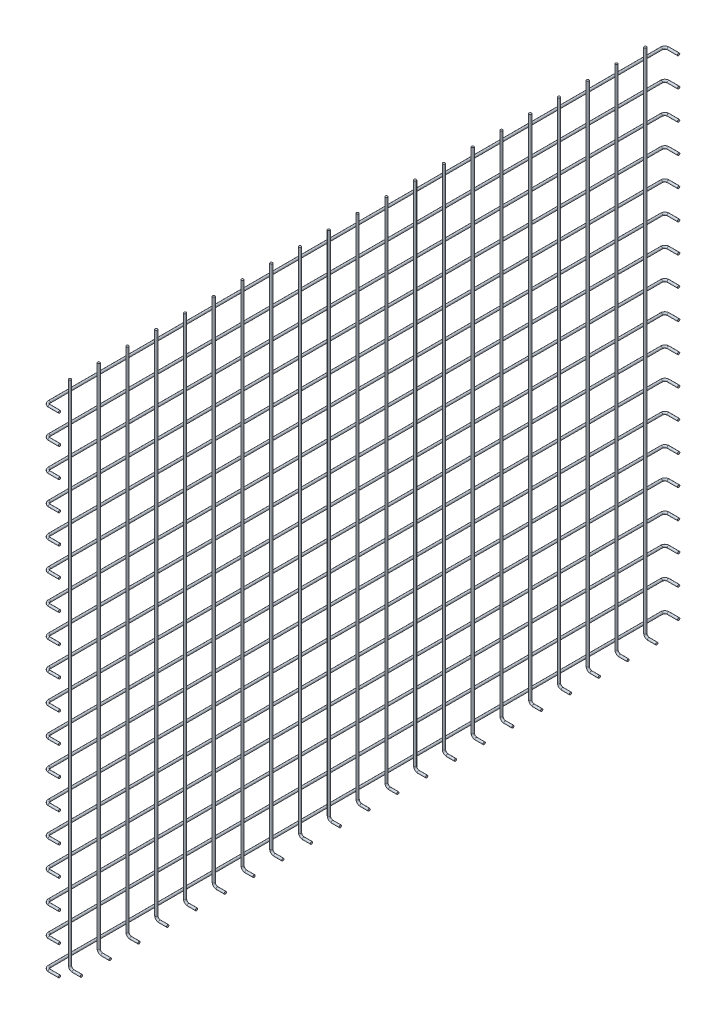
from build123d import *

# Parameters (mm, degrees)
SKETCH_2_R             = 2
PATTERN_LINEAR_2_COUNT = 11
PATTERN_LINEAR_2_PITCH = 50
PATTERN_LINEAR_3_COUNT = 11
PATTERN_LINEAR_3_PITCH = 50
SKETCH_4_R             = 2
PATTERN_LINEAR_4_COUNT = 18
PATTERN_LINEAR_4_PITCH = 50


with BuildPart() as part:
    # По траектории1: sweep along a path in Эскиз1
    with BuildLine(Plane.XY) as sweep_1_path:
        Line((20, 2), (6, 2))
        ThreePointArc((6, 2), (1.757359313, 3.757359313), (0, 8))
        Line((0, 8), (0, 890))
    # Эскиз2 → По траектории1 (sweep)
    with BuildSketch(Plane(origin=(20, 0, 0), x_dir=(0, 0, -1), z_dir=(1, 0, 0))):
        with Locations((0, 2)):
            Circle(SKETCH_2_R)
    sweep(path=sweep_1_path.line)


with BuildPart() as pattern_linear_2_1:
    # Линейный массив2: pattern copy
    add(part.part.moved(Location(Vector(0, 0, -1) * (1 * PATTERN_LINEAR_2_PITCH))))


with BuildPart() as pattern_linear_2_2:
    # Линейный массив2: pattern copy
    add(part.part.moved(Location(Vector(0, 0, -1) * (2 * PATTERN_LINEAR_2_PITCH))))


with BuildPart() as pattern_linear_2_3:
    # Линейный массив2: pattern copy
    add(part.part.moved(Location(Vector(0, 0, -1) * (3 * PATTERN_LINEAR_2_PITCH))))


with BuildPart() as pattern_linear_2_4:
    # Линейный массив2: pattern copy
    add(part.part.moved(Location(Vector(0, 0, -1) * (4 * PATTERN_LINEAR_2_PITCH))))


with BuildPart() as pattern_linear_2_5:
    # Линейный массив2: pattern copy
    add(part.part.moved(Location(Vector(0, 0, -1) * (5 * PATTERN_LINEAR_2_PITCH))))


with BuildPart() as pattern_linear_2_6:
    # Линейный массив2: pattern copy
    add(part.part.moved(Location(Vector(0, 0, -1) * (6 * PATTERN_LINEAR_2_PITCH))))


with BuildPart() as pattern_linear_2_7:
    # Линейный массив2: pattern copy
    add(part.part.moved(Location(Vector(0, 0, -1) * (7 * PATTERN_LINEAR_2_PITCH))))


with BuildPart() as pattern_linear_2_8:
    # Линейный массив2: pattern copy
    add(part.part.moved(Location(Vector(0, 0, -1) * (8 * PATTERN_LINEAR_2_PITCH))))


with BuildPart() as pattern_linear_2_9:
    # Линейный массив2: pattern copy
    add(part.part.moved(Location(Vector(0, 0, -1) * (9 * PATTERN_LINEAR_2_PITCH))))


with BuildPart() as pattern_linear_2_10:
    # Линейный массив2: pattern copy
    add(part.part.moved(Location(Vector(0, 0, -1) * (10 * PATTERN_LINEAR_2_PITCH))))


with BuildPart() as pattern_linear_3_1:
    # Линейный массив3: pattern copy
    add(part.part.moved(Location(Vector(0, 0, 1) * (1 * PATTERN_LINEAR_3_PITCH))))


with BuildPart() as pattern_linear_3_2:
    # Линейный массив3: pattern copy
    add(part.part.moved(Location(Vector(0, 0, 1) * (2 * PATTERN_LINEAR_3_PITCH))))


with BuildPart() as pattern_linear_3_3:
    # Линейный массив3: pattern copy
    add(part.part.moved(Location(Vector(0, 0, 1) * (3 * PATTERN_LINEAR_3_PITCH))))


with BuildPart() as pattern_linear_3_4:
    # Линейный массив3: pattern copy
    add(part.part.moved(Location(Vector(0, 0, 1) * (4 * PATTERN_LINEAR_3_PITCH))))


with BuildPart() as pattern_linear_3_5:
    # Линейный массив3: pattern copy
    add(part.part.moved(Location(Vector(0, 0, 1) * (5 * PATTERN_LINEAR_3_PITCH))))


with BuildPart() as pattern_linear_3_6:
    # Линейный массив3: pattern copy
    add(part.part.moved(Location(Vector(0, 0, 1) * (6 * PATTERN_LINEAR_3_PITCH))))


with BuildPart() as pattern_linear_3_7:
    # Линейный массив3: pattern copy
    add(part.part.moved(Location(Vector(0, 0, 1) * (7 * PATTERN_LINEAR_3_PITCH))))


with BuildPart() as pattern_linear_3_8:
    # Линейный массив3: pattern copy
    add(part.part.moved(Location(Vector(0, 0, 1) * (8 * PATTERN_LINEAR_3_PITCH))))


with BuildPart() as pattern_linear_3_9:
    # Линейный массив3: pattern copy
    add(part.part.moved(Location(Vector(0, 0, 1) * (9 * PATTERN_LINEAR_3_PITCH))))


with BuildPart() as pattern_linear_3_10:
    # Линейный массив3: pattern copy
    add(part.part.moved(Location(Vector(0, 0, 1) * (10 * PATTERN_LINEAR_3_PITCH))))


with BuildPart() as body_22:
    # По траектории2: sweep along a path in Эскиз3
    with BuildLine(Plane(origin=(0, 20, 0), x_dir=(1, 0, 0), z_dir=(0, 1, 0))) as sweep_2_path:
        Line((20, 538), (2, 538))
        ThreePointArc((2, 538), (-2.242640687, 536.242640687), (-4, 532))
        Line((-4, 532), (-4, -532))
        ThreePointArc((-4, -532), (-2.242640687, -536.242640687), (2, -538))
        Line((2, -538), (20, -538))
    # Эскиз4 → По траектории2 (sweep)
    with BuildSketch(Plane(origin=(20, 0, 0), x_dir=(0, 0, -1), z_dir=(1, 0, 0))):
        with Locations((538, 20)):
            Circle(SKETCH_4_R)
    sweep_2 = sweep(path=sweep_2_path.line)


with BuildPart() as pattern_linear_4_1:
    # Линейный массив4: По траектории2 ×18
    with Locations(*[(0, i * PATTERN_LINEAR_4_PITCH, 0) for i in range(1, PATTERN_LINEAR_4_COUNT)]):
        add(sweep_2)


solid = Compound([part.part, pattern_linear_2_1.part, pattern_linear_2_2.part, pattern_linear_2_3.part, pattern_linear_2_4.part, pattern_linear_2_5.part, pattern_linear_2_6.part, pattern_linear_2_7.part, pattern_linear_2_8.part, pattern_linear_2_9.part, pattern_linear_2_10.part, pattern_linear_3_1.part, pattern_linear_3_2.part, pattern_linear_3_3.part, pattern_linear_3_4.part, pattern_linear_3_5.part, pattern_linear_3_6.part, pattern_linear_3_7.part, pattern_linear_3_8.part, pattern_linear_3_9.part, pattern_linear_3_10.part, body_22.part, pattern_linear_4_1.part])
